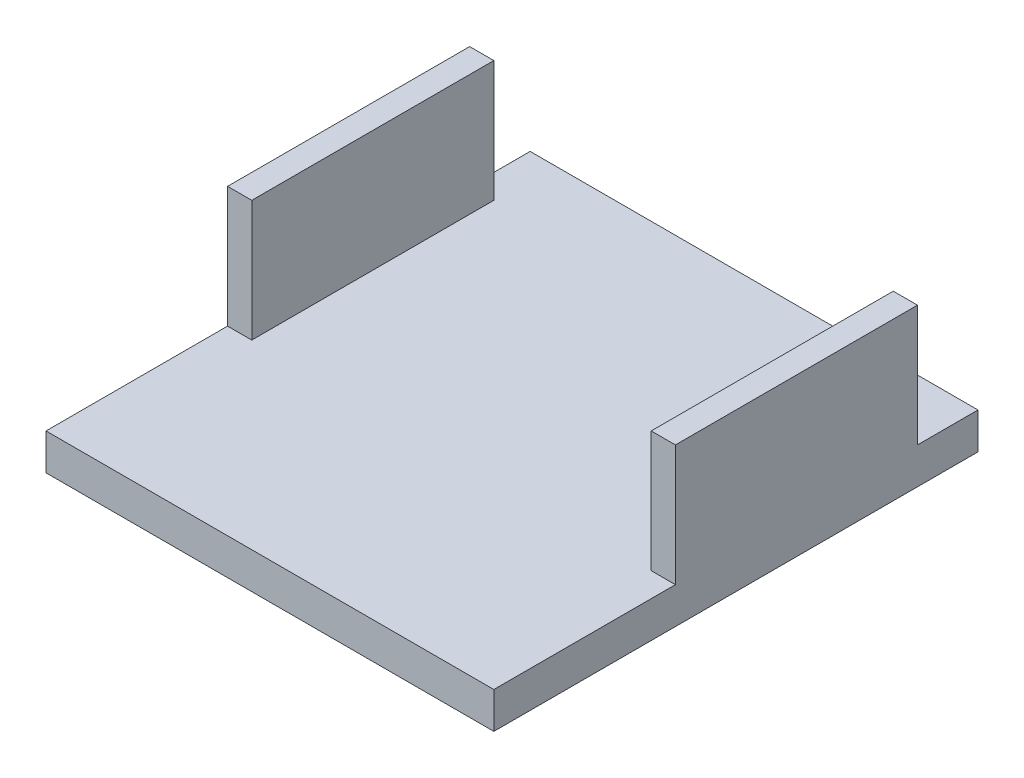
from build123d import *

# Parameters (mm, degrees)
SKETCH_1_W      = 37
SKETCH_1_H      = 40
EXTRUDE_1_DEPTH = 3
SKETCH_2_W      = 2
SKETCH_2_H      = 20
EXTRUDE_2_DEPTH = 10


with BuildPart() as part:
    # 草图1 → 凸台-拉伸1 (new body)
    with BuildSketch(Plane(origin=(0, 0, 0), x_dir=(1, 0, 0), z_dir=(0, 1, 0))):
        with Locations((18.5, 20)):
            Rectangle(SKETCH_1_W, SKETCH_1_H)
    extrude(amount=EXTRUDE_1_DEPTH)

    # 草图2 → 凸台-拉伸2 (add)
    with BuildSketch(Plane(origin=(0, 3, 0), x_dir=(1, 0, 0), z_dir=(0, 1, 0))):
        with Locations((36, 25)):
            Rectangle(SKETCH_2_W, SKETCH_2_H)
        with Locations((1, 25)):
            Rectangle(SKETCH_2_W, SKETCH_2_H)
    extrude(amount=EXTRUDE_2_DEPTH)


solid = part.part
